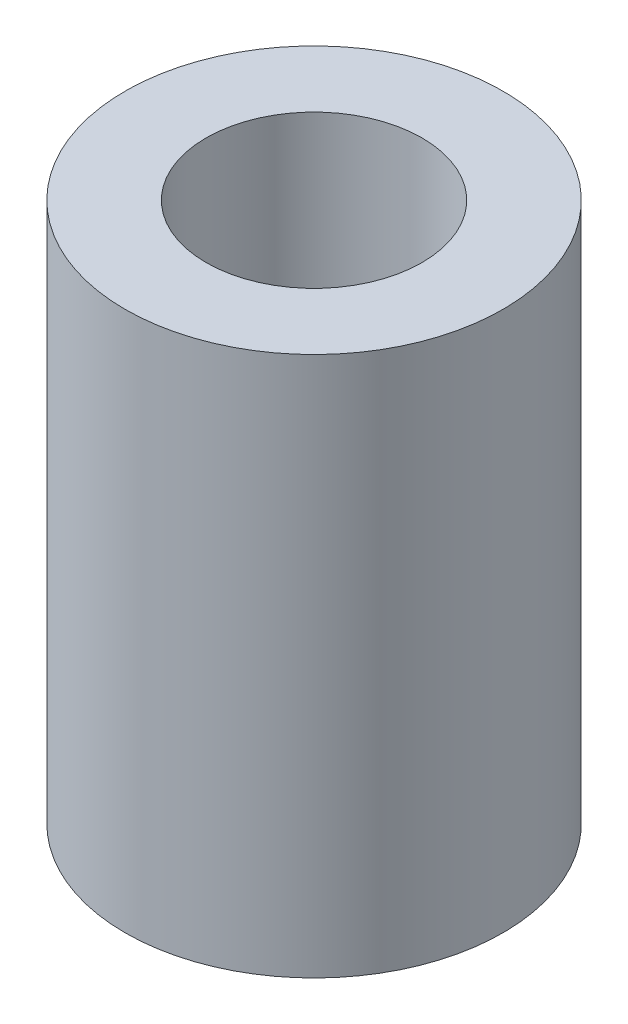
from build123d import *

# Parameters (mm, degrees)
SKETCH_1_R        = 3.5
SKETCH_1_R_2      = 2
EXTRUDE_323_DEPTH = 10


with BuildPart() as part:
    # Эскиз1 → Extrude 323 (new body)
    with BuildSketch(Plane(origin=(0, 0, 0), x_dir=(1, 0, 0), z_dir=(0, 1, 0))):
        with Locations(Location((0, 0, 0), (0, 0, 270))):
            Circle(SKETCH_1_R)
        with Locations(Location((0, 0, 0), (0, 0, 270))):
            Circle(SKETCH_1_R_2, mode=Mode.SUBTRACT)
    extrude(amount=EXTRUDE_323_DEPTH)


solid = part.part
